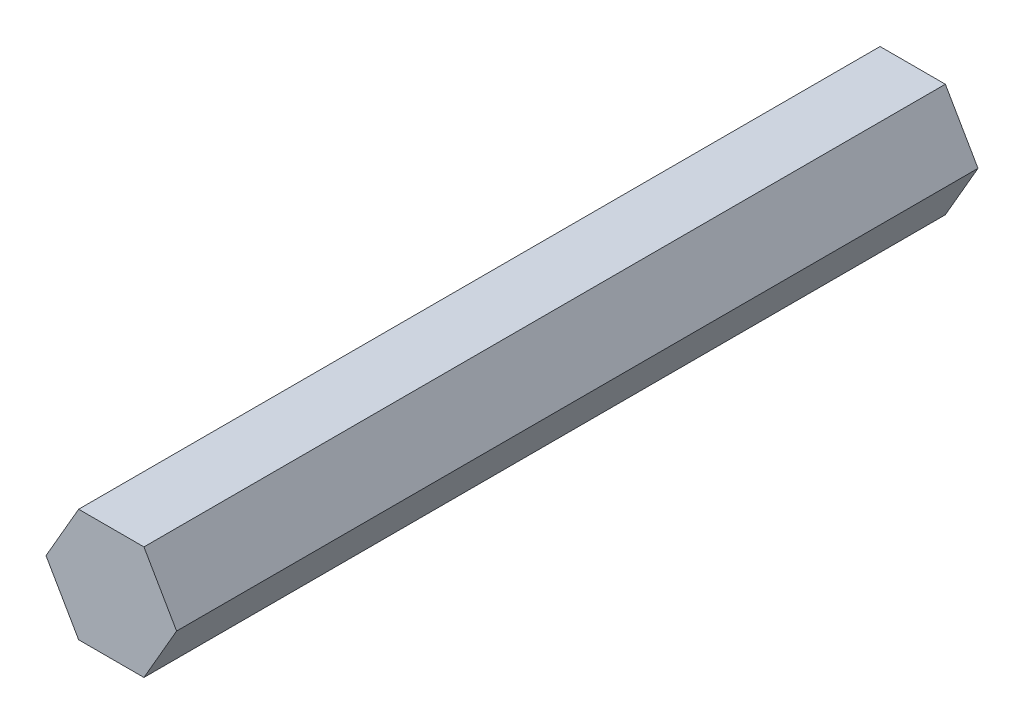
from build123d import *

# Parameters (mm, degrees)
BOSS_EXTRUDE1_DEPTH = 90


with BuildPart() as part:
    # Sketch1 → Boss-Extrude1 (new body)
    with BuildSketch(Plane.XY):
        Polygon((7.332348419, 0), (3.666174209, 6.35), (-3.666174209, 6.35), (-7.332348419, 0), (-3.666174209, -6.35), (3.666174209, -6.35), align=None)
    extrude(amount=BOSS_EXTRUDE1_DEPTH)


solid = part.part
